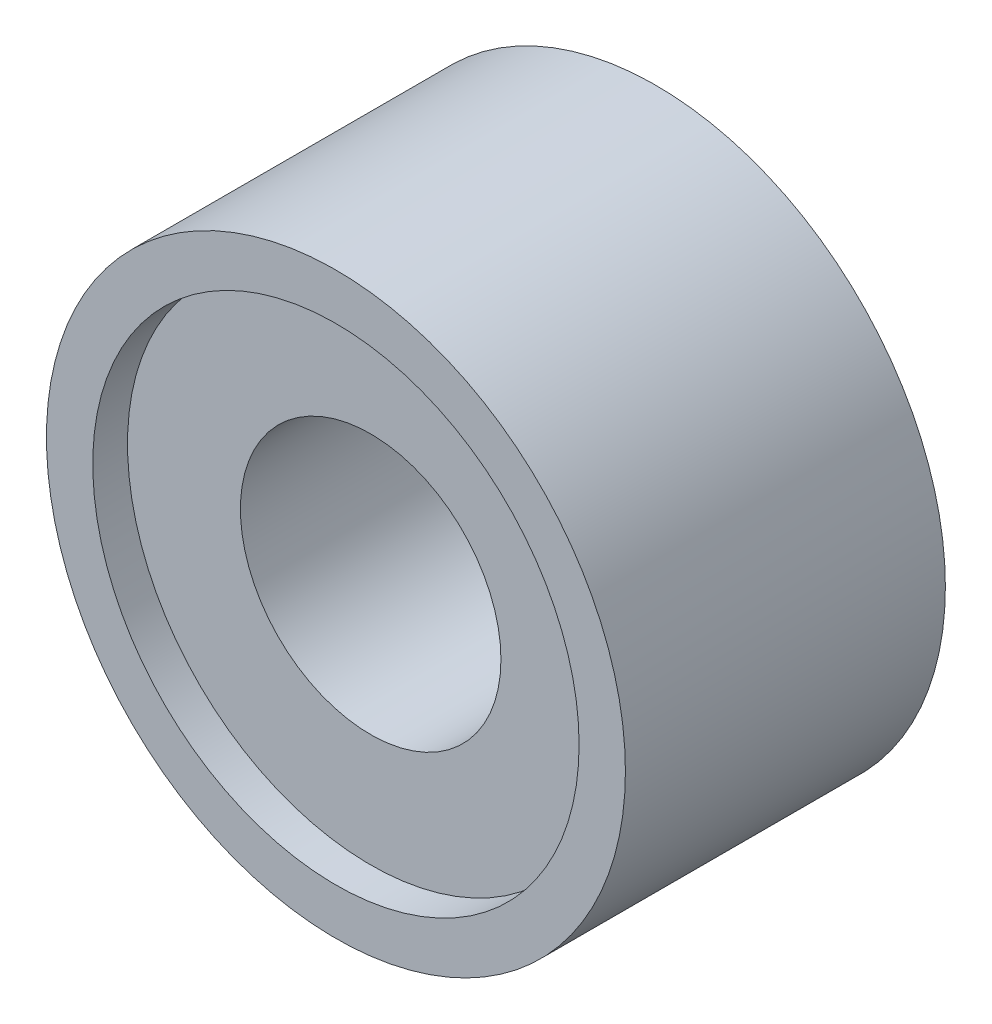
from build123d import *

# Parameters (mm, degrees)
CROQUIS3_W            = 27.632411408
CROQUIS3_H            = 25
CROQUIS5_R            = 11.25
CORTAR_EXTRUIR1_DEPTH = 45.872599214
CROQUIS6_R            = 21
CORTAR_EXTRUIR2_DEPTH = 3


with BuildPart() as part:
    # Croquis3 → Revolución5 (revolve)
    with BuildSketch(Plane(origin=(0, 0, 0), x_dir=(0, 0, -1), z_dir=(1, 0, 0)), mode=Mode.PRIVATE) as revoluci_n5_sk:
        with Locations((13.816205704, -12.5)):
            Rectangle(CROQUIS3_W, CROQUIS3_H)
    revolve(revoluci_n5_sk.sketch.rotate(Axis((0, 0, 45.885013439), (0, 0, -1)), 270), axis=Axis((0, 0, 45.885013439), (0, 0, -1)))

    # Croquis5 → Cortar-Extruir1 (cut, through all)
    with BuildSketch(Plane.XY):
        Circle(CROQUIS5_R)
    extrude(amount=-CORTAR_EXTRUIR1_DEPTH, mode=Mode.SUBTRACT)

    # Croquis6 → Cortar-Extruir2 (cut)
    with BuildSketch(Plane.XY):
        Circle(CROQUIS6_R)
    extrude(amount=-CORTAR_EXTRUIR2_DEPTH, mode=Mode.SUBTRACT)


solid = part.part
